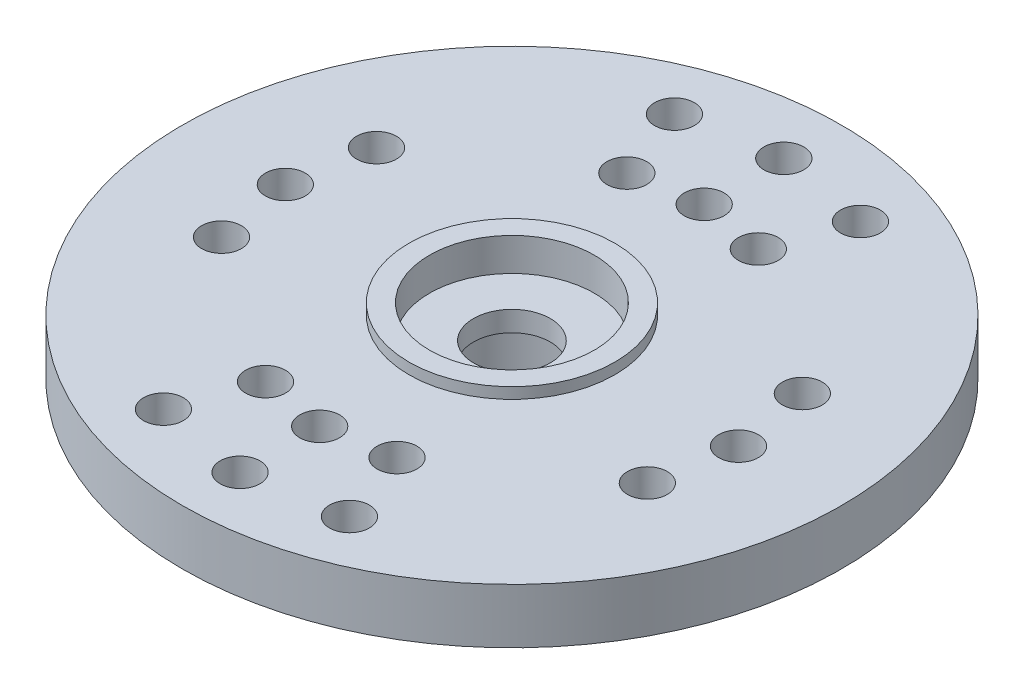
from build123d import *

# Parameters (mm, degrees)
SKETCH2_R          = 0.725
CUT_EXTRUDE1_DEPTH = 18.567344705


with BuildPart() as part:
    # Sketch1 → Revolve1 (revolve)
    with BuildSketch(Plane.XY, mode=Mode.PRIVATE) as revolve1_sk:
        Polygon((-3.75, 0), (-12, 0), (-12, -2), (-4.44, -2), (-4.44, -4.54), (-2.65, -4.54), (-2.65, -1.54), (-1.4, -1.54), (-1.4, -0.8), (-3, -0.8), (-3, 0.4), (-3.75, 0.4), align=None)
    revolve(revolve1_sk.sketch.rotate(Axis((0, 0, 0), (0, -1, 0)), 270), axis=Axis((0, 0, 0), (0, -1, 0)))

    # Sketch2 → Cut-Extrude1 (cut, through all)
    with BuildSketch(Plane(origin=(0, 0, 0), x_dir=(1, 0, 0), z_dir=(0, 1, 0))):
        with Locations(Location((-8.25, 0, 0), (0, 0, 270))):
            Circle(SKETCH2_R)
        with Locations(Location((-7.752464121, 2.821666182, 0), (0, 0, 270))):
            Circle(SKETCH2_R)
        with Locations(Location((0, 7, 0), (0, 0, 270))):
            Circle(SKETCH2_R)
        with Locations(Location((0, 9.9, 0), (0, 0, 270))):
            Circle(SKETCH2_R)
        with Locations(Location((2.394141003, 6.577848346, 0), (0, 0, 270))):
            Circle(SKETCH2_R)
        with Locations(Location((3.385999419, 9.302956946, 0), (0, 0, 270))):
            Circle(SKETCH2_R)
        with Locations(Location((-2.394141003, 6.577848346, 0), (0, 0, 90))):
            Circle(SKETCH2_R)
        with Locations(Location((-3.385999419, 9.302956946, 0), (0, 0, 90))):
            Circle(SKETCH2_R)
        with Locations(Location((-7.752464121, -2.821666182, 0), (0, 0, 90))):
            Circle(SKETCH2_R)
        with Locations(Location((7.752464121, -2.821666182, 0), (0, 0, 270))):
            Circle(SKETCH2_R)
        with Locations(Location((7.752464121, 2.821666182, 0), (0, 0, 90))):
            Circle(SKETCH2_R)
        with Locations(Location((8.25, 0, 0), (0, 0, 270))):
            Circle(SKETCH2_R)
        with Locations(Location((2.394141003, -6.577848346, 0), (0, 0, 90))):
            Circle(SKETCH2_R)
        with Locations(Location((3.385999419, -9.302956946, 0), (0, 0, 90))):
            Circle(SKETCH2_R)
        with Locations(Location((0, -9.9, 0), (0, 0, 270))):
            Circle(SKETCH2_R)
        with Locations(Location((0, -7, 0), (0, 0, 270))):
            Circle(SKETCH2_R)
        with Locations(Location((-2.394141003, -6.577848346, 0), (0, 0, 270))):
            Circle(SKETCH2_R)
        with Locations(Location((-3.385999419, -9.302956946, 0), (0, 0, 270))):
            Circle(SKETCH2_R)
    extrude(amount=-CUT_EXTRUDE1_DEPTH, mode=Mode.SUBTRACT)


solid = part.part
